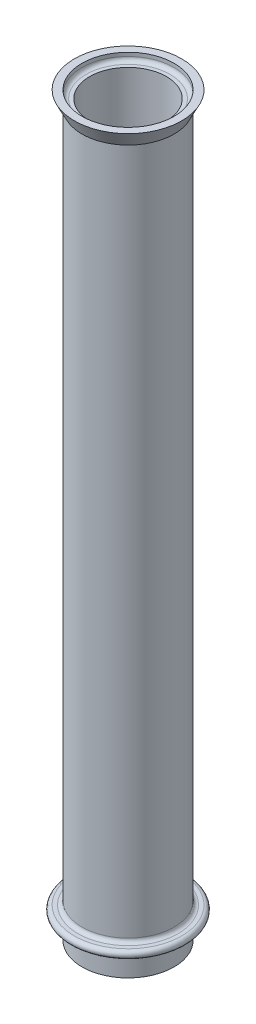
from build123d import *


with BuildPart() as part:
    # Sketch1 → Revolve1 (revolve)
    with BuildSketch(Plane.XY, mode=Mode.PRIVATE) as revolve1_sk:
        with BuildLine():
            Line((-7.9375, 0), (-7.9375, 150.8125))
            Line((-7.9375, 150.8125), (-8.6995, 150.8125))
            ThreePointArc((-8.6995, 150.8125), (-9.283216648, 151.054283352), (-9.525, 151.638))
            Line((-9.525, 151.638), (-9.525, 152.4))
            Line((-9.525, 152.4), (-11.1125, 152.4))
            Line((-11.1125, 152.4), (-9.525, 149.225))
            Line((-9.525, 149.225), (-9.525, 7.14375))
            ThreePointArc((-9.525, 7.14375), (-9.757483992, 6.582483992), (-10.31875, 6.35))
            Line((-10.31875, 6.35), (-11.1125, 6.35))
            ThreePointArc((-11.1125, 6.35), (-11.90625, 5.55625), (-11.1125, 4.7625))
            Line((-11.1125, 4.7625), (-10.31875, 4.7625))
            ThreePointArc((-10.31875, 4.7625), (-9.757483992, 4.530016008), (-9.525, 3.96875))
            Line((-9.525, 3.96875), (-9.525, 0))
            Line((-9.525, 0), (-7.9375, 0))
        make_face()
    revolve(revolve1_sk.sketch.rotate(Axis((0, 0, 0), (0, 1, 0)), 270), axis=Axis((0, 0, 0), (0, 1, 0)))


solid = part.part
